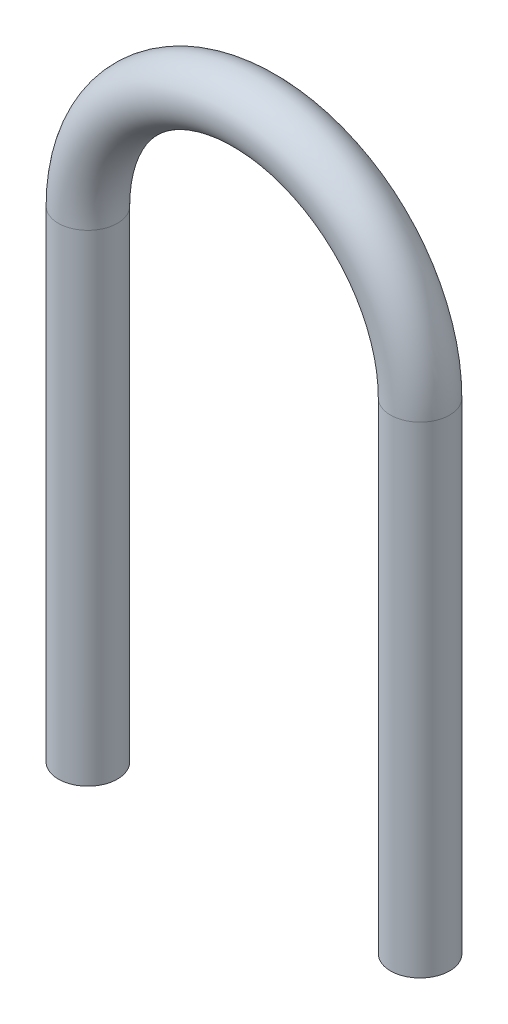
from build123d import *

# Parameters (mm, degrees)
CROQUIS1_R = 2.38125


with BuildPart() as part:
    # Barrer1: sweep along a path in Croquis2
    with BuildLine(Plane.XY) as barrer1_path:
        Line((-13.38125, 0), (-13.38125, 38.78125))
        ThreePointArc((-13.38125, 38.78125), (0, 52.1625), (13.38125, 38.78125))
        Line((13.38125, 38.78125), (13.38125, 0))
    # Croquis1 → Barrer1 (sweep)
    with BuildSketch(Plane(origin=(0, 0, 0), x_dir=(1, 0, 0), z_dir=(0, 1, 0))):
        with Locations((13.38125, 0)):
            Circle(CROQUIS1_R)
    sweep(path=barrer1_path.line)


solid = part.part
